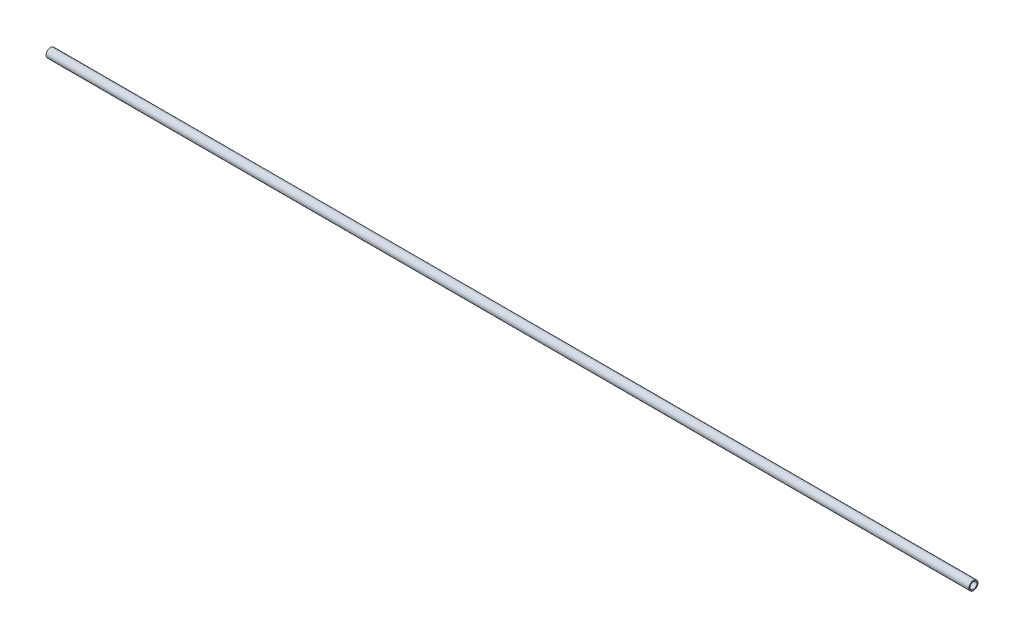
from build123d import *

# Parameters (mm, degrees)
SKETCH1_R           = 12.7
SKETCH1_R_2         = 9.652
BOSS_EXTRUDE1_DEPTH = 2606.04


with BuildPart() as part:
    # Sketch1 → Boss-Extrude1 (new body)
    with BuildSketch(Plane(origin=(0, 0, 0), x_dir=(0, 0, -1), z_dir=(1, 0, 0))):
        Circle(SKETCH1_R)
        Circle(SKETCH1_R_2, mode=Mode.SUBTRACT)
    extrude(amount=BOSS_EXTRUDE1_DEPTH)


solid = part.part
